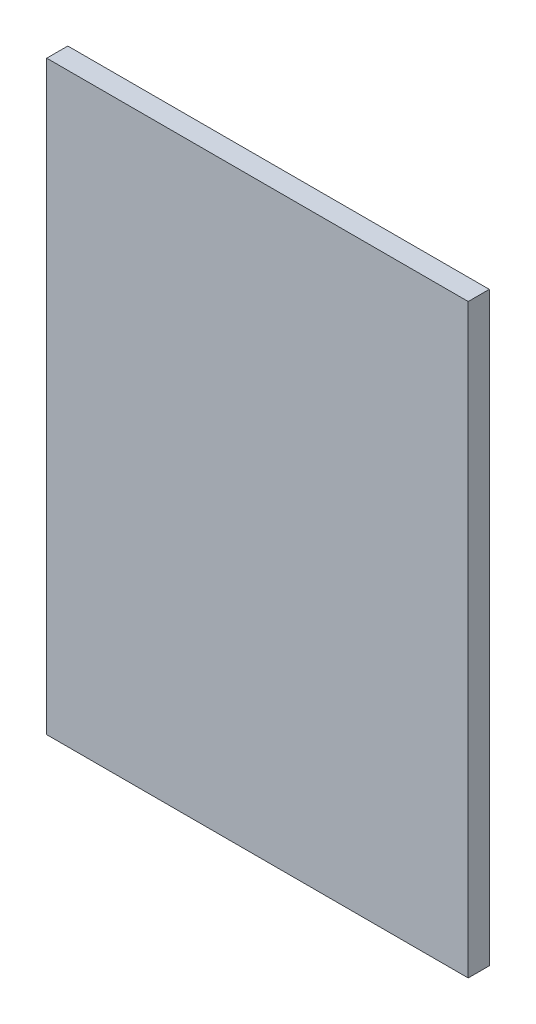
from build123d import *

# Parameters (mm, degrees)
ESBO_O1_W                = 125
ESBO_O1_H                = 175
RESSALTO_EXTRUS_O1_DEPTH = 5
ESBO_O2_W                = 2.5
ESBO_O2_H                = 49
RESSALTO_EXTRUS_O2_DEPTH = 5.4
FILETE1_R                = 2
ESBO_O3_R                = 1.35
CORTE_EXTRUS_O2_DEPTH    = 140.879984272
CORTE_EXTRUS_O3_DEPTH    = 108.664571703


with BuildPart() as part:
    # Esboço1 → Ressalto-extrusão1 (new body)
    with BuildSketch(Plane.XY):
        Rectangle(ESBO_O1_W, ESBO_O1_H)
    extrude(amount=RESSALTO_EXTRUS_O1_DEPTH)

    # Esboço2 → Ressalto-extrusão2 (add)
    with BuildSketch(Plane(origin=(0, 0, 0), x_dir=(-1, 0, 0), z_dir=(0, 0, -1))):
        with Locations((7.75, 0)):
            Rectangle(ESBO_O2_W, ESBO_O2_H)
        with Locations((45.25, 0)):
            Rectangle(ESBO_O2_W, ESBO_O2_H)
    extrude(amount=RESSALTO_EXTRUS_O2_DEPTH)

    # Filete1
    filete1_edges = [part.edges().sort_by_distance(p)[0] for p in [
        (-7.75, 24.5, -5.4),
        (-7.75, -24.5, -5.4),
        (-45.25, 24.5, -5.4),
        (-45.25, -24.5, -5.4),
    ]]
    fillet(filete1_edges, radius=FILETE1_R)

    # Esboço3 → Corte-extrusão2 (cut, through all)
    with BuildSketch(Plane.ZY.offset(46.5)):
        with Locations(Location((-2.7, -21.9, 0), (0, 0, 270))):
            Circle(ESBO_O3_R)
        with Locations(Location((-2.7, 21.9, 0), (0, 0, 270))):
            Circle(ESBO_O3_R)
        with Locations(Location((-2.7, 0, 0), (0, 0, 270))):
            Circle(ESBO_O3_R)
    extrude(amount=-CORTE_EXTRUS_O2_DEPTH, mode=Mode.SUBTRACT)

    # Esboço4 → Corte-extrusão3 (cut, through all)
    with BuildSketch(Plane(origin=(0, 0, 0), x_dir=(-1, 0, 0), z_dir=(0, 0, -1))):
        Polygon((62.5, -87.5), (62.5, -69.5), (-37.5, -69.5), (-37.5, 69.5), (62.5, 69.5), (62.5, 87.5), (-62.5, 87.5), (-62.5, -87.5), align=None)
    extrude(amount=-CORTE_EXTRUS_O3_DEPTH, mode=Mode.SUBTRACT)


solid = part.part
